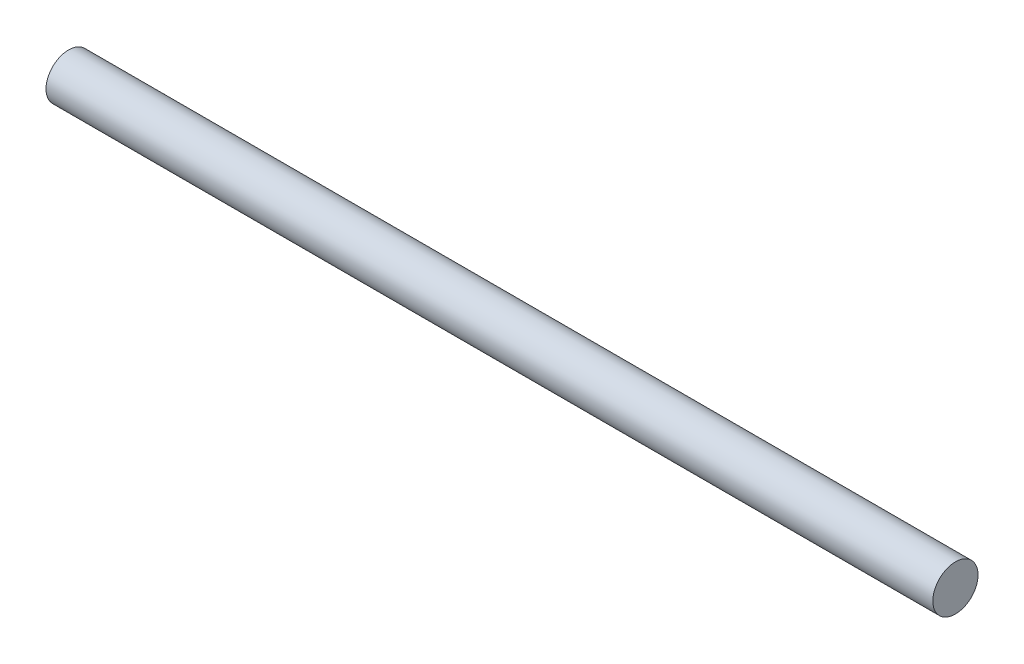
from build123d import *

# Parameters (mm, degrees)
SKETCH_1_W = 49
SKETCH_1_H = 1.25


with BuildPart() as part:
    # Эскиз1 → Повернуть1 (revolve)
    with BuildSketch(Plane.XY, mode=Mode.PRIVATE) as revolve_1_sk:
        with Locations((0, 0.625)):
            Rectangle(SKETCH_1_W, SKETCH_1_H)
    revolve(revolve_1_sk.sketch.rotate(Axis((-24.5, 0, 0), (1, 0, 0)), 90), axis=Axis((-24.5, 0, 0), (1, 0, 0)))


solid = part.part
